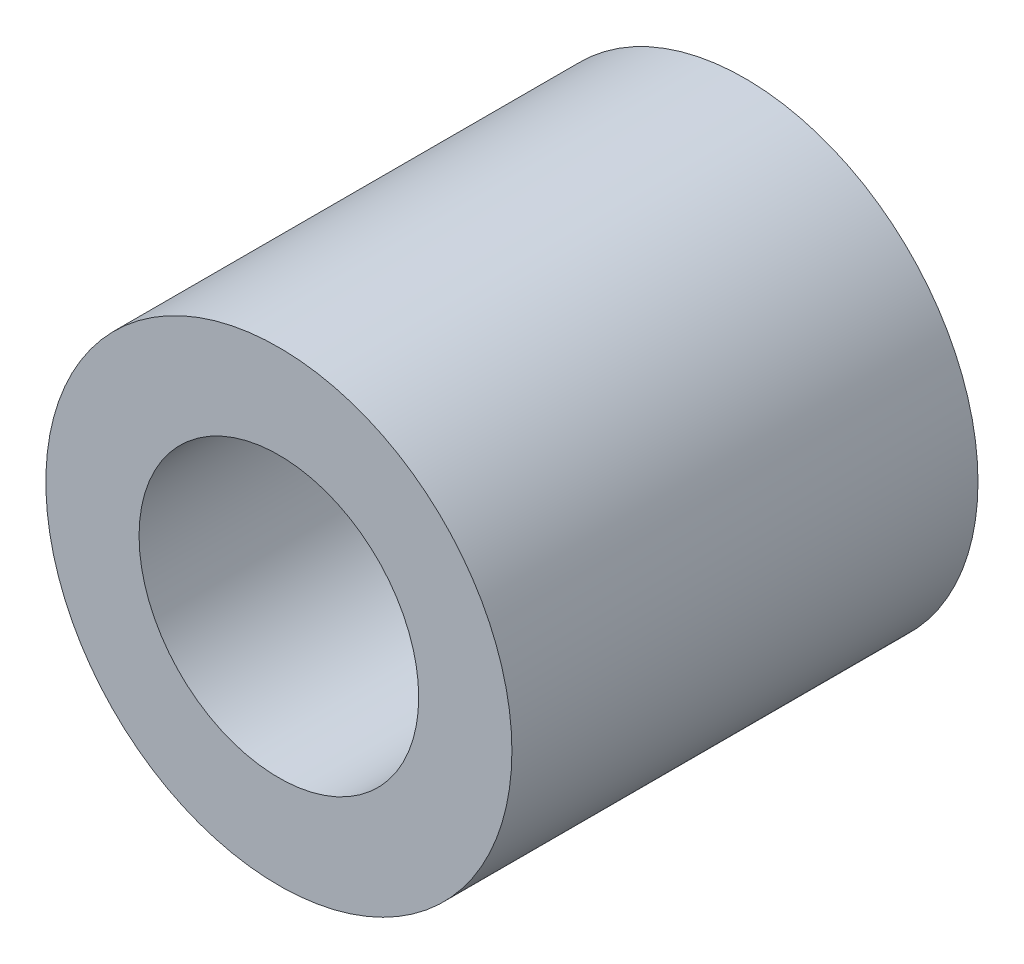
from build123d import *

# Parameters (mm, degrees)
SKETCH_1_R      = 2.5
SKETCH_1_R_2    = 1.5
EXTRUDE_1_DEPTH = 5


with BuildPart() as part:
    # 草图1 → 凸台-拉伸1 (new body)
    with BuildSketch(Plane.XY):
        Circle(SKETCH_1_R)
        Circle(SKETCH_1_R_2, mode=Mode.SUBTRACT)
    extrude(amount=EXTRUDE_1_DEPTH)


solid = part.part
